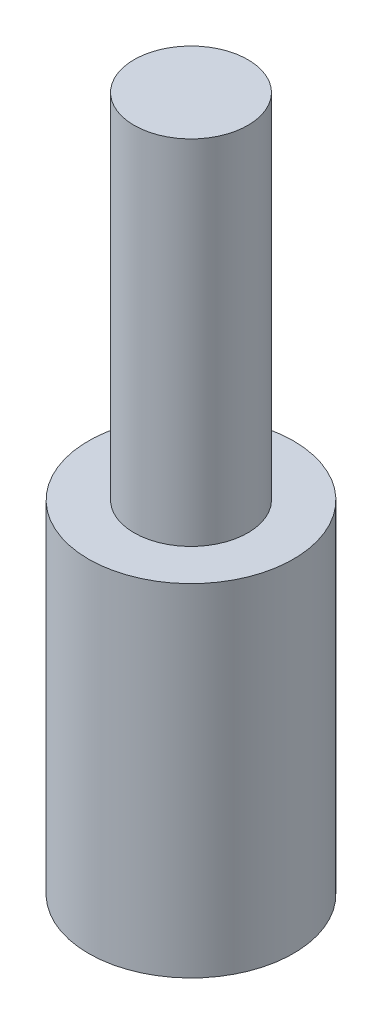
from build123d import *

# Parameters (mm, degrees)
SKETCH2_R           = 4.5
BOSS_EXTRUDE1_DEPTH = 12
SKETCH3_R           = 4.5
BOSS_EXTRUDE2_DEPTH = 3
SKETCH4_R           = 2.5
BOSS_EXTRUDE3_DEPTH = 15.5


with BuildPart() as part:
    # Sketch2 → Boss-Extrude1 (new body)
    with BuildSketch(Plane(origin=(0, 0, 0), x_dir=(1, 0, 0), z_dir=(0, 1, 0))):
        with Locations(Location((0, 0, 0), (0, 0, 270))):
            Circle(SKETCH2_R)
        with BuildLine():
            ThreePointArc((1.658312395, 2.5), (0, -3), (-1.658312395, 2.5))
            Line((-1.658312395, 2.5), (1.658312395, 2.5))
        make_face(mode=Mode.SUBTRACT)
    extrude(amount=BOSS_EXTRUDE1_DEPTH)

    # Sketch3 → Boss-Extrude2 (add)
    with BuildSketch(Plane(origin=(0, 12, 0), x_dir=(1, 0, 0), z_dir=(0, 1, 0))):
        with Locations(Location((0, 0, 0), (0, 0, 270))):
            Circle(SKETCH3_R)
    extrude(amount=BOSS_EXTRUDE2_DEPTH)

    # Sketch4 → Boss-Extrude3 (add)
    with BuildSketch(Plane(origin=(0, 15, 0), x_dir=(1, 0, 0), z_dir=(0, 1, 0))):
        with Locations(Location((0, 0, 0), (0, 0, 270))):
            Circle(SKETCH4_R)
    extrude(amount=BOSS_EXTRUDE3_DEPTH)


solid = part.part
